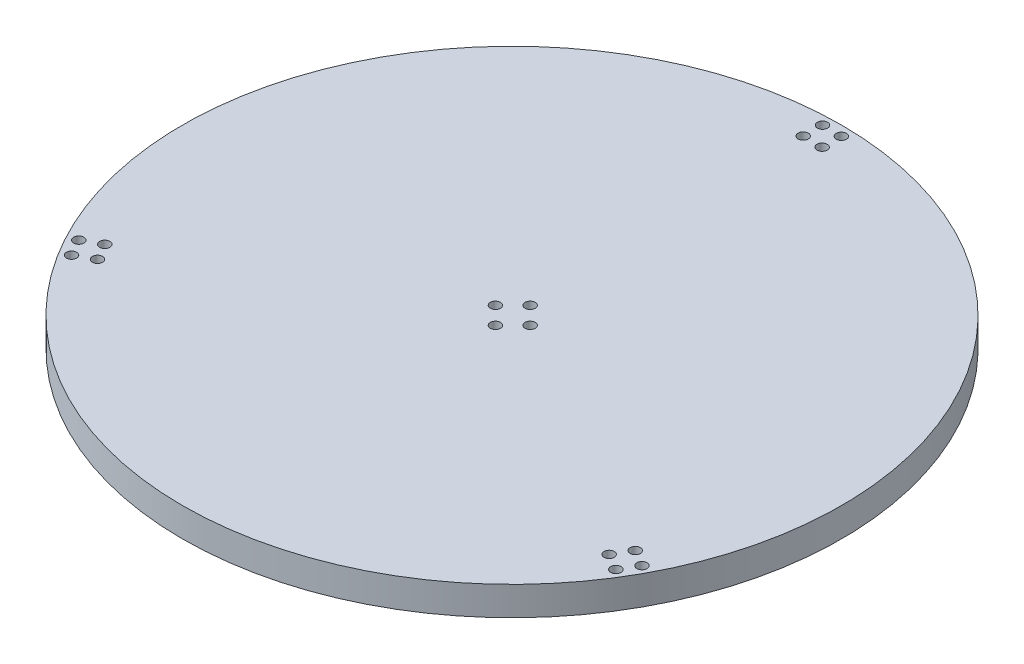
from build123d import *

# Parameters (mm, degrees)
SKETCH2_R           = 217.17
BOSS_EXTRUDE1_DEPTH = 19.05
SKETCH3_R           = 3.3782
CUT_EXTRUDE1_DEPTH  = 19.05


with BuildPart() as part:
    # Sketch2 → Boss-Extrude1 (new body)
    with BuildSketch(Plane(origin=(0, 0, 0), x_dir=(1, 0, 0), z_dir=(0, 1, 0))):
        with Locations(Location((0, 0, 0), (0, 0, 90))):
            Circle(SKETCH2_R)
    extrude(amount=BOSS_EXTRUDE1_DEPTH)

    # Sketch3 → Cut-Extrude1 (cut)
    with BuildSketch(Plane(origin=(0, 19.05, 0), x_dir=(1, 0, 0), z_dir=(0, 1, 0))):
        with Locations(Location((-6.217918031, 210.823707214, 0), (0, 0, 270))):
            Circle(SKETCH3_R)
        with Locations(Location((6.353707214, 210.687918031, 0), (0, 0, 270))):
            Circle(SKETCH3_R)
        with Locations(Location((6.217918031, 198.116292786, 0), (0, 0, 270))):
            Circle(SKETCH3_R)
        with Locations(Location((-6.353707214, 198.252081969, 0), (0, 0, 270))):
            Circle(SKETCH3_R)
        with Locations(Location((185.687645183, -100.026978634, 0), (0, 0, 270))):
            Circle(SKETCH3_R)
        with Locations(Location((179.284235678, -110.846430871, 0), (0, 0, 270))):
            Circle(SKETCH3_R)
        with Locations(Location((0.267466586, -11.178843279, 0), (0, 0, 270))):
            Circle(SKETCH3_R)
        with Locations(Location((-11.162533414, 0.251156721, 0), (0, 0, 270))):
            Circle(SKETCH3_R)
        with Locations(Location((0.267466586, 11.681156721, 0), (0, 0, 270))):
            Circle(SKETCH3_R)
        with Locations(Location((11.697466586, 0.251156721, 0), (0, 0, 270))):
            Circle(SKETCH3_R)
        with Locations(Location((168.464783441, -104.443021366, 0), (0, 0, 270))):
            Circle(SKETCH3_R)
        with Locations(Location((174.868192945, -93.623569129, 0), (0, 0, 270))):
            Circle(SKETCH3_R)
        with Locations(Location((-179.469727152, -110.79672858, 0), (0, 0, 270))):
            Circle(SKETCH3_R)
        with Locations(Location((-185.637942892, -99.84148716, 0), (0, 0, 270))):
            Circle(SKETCH3_R)
        with Locations(Location((-174.682701472, -93.67327142, 0), (0, 0, 270))):
            Circle(SKETCH3_R)
        with Locations(Location((-168.514485731, -104.62851284, 0), (0, 0, 270))):
            Circle(SKETCH3_R)
    extrude(amount=-CUT_EXTRUDE1_DEPTH, mode=Mode.SUBTRACT)


solid = part.part
